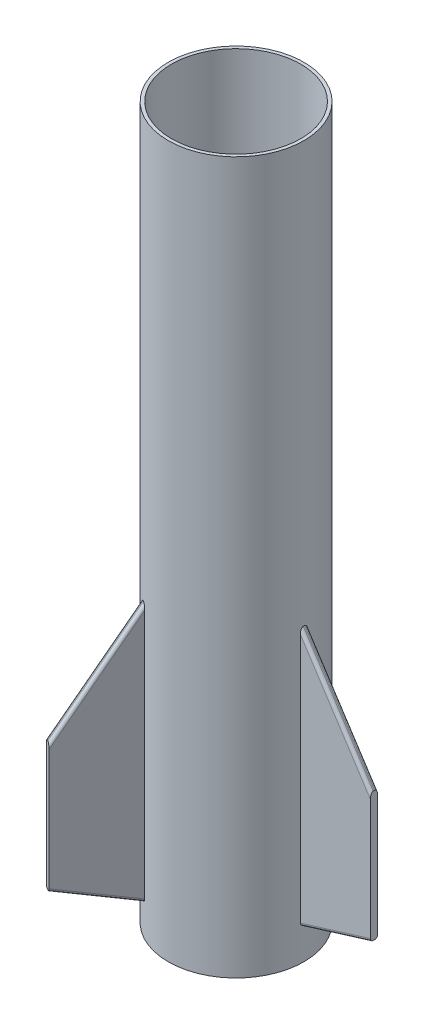
from build123d import *

# Parameters (mm, degrees)
SKETCH3_R                = 40.005
SKETCH3_R_2              = 38.1
BOSS_EXTRUDE1_DEPTH      = 419.1
BOSS_EXTRUDE2_DEPTH      = 2.159
BOSS_EXTRUDE2_DEPTH_BACK = 2.159
FILLET1_R                = 1.778
CIRPATTERN1_COUNT        = 3


with BuildPart() as part:
    # Sketch3 → Boss-Extrude1 (new body)
    with BuildSketch(Plane(origin=(0, 0, 0), x_dir=(1, 0, 0), z_dir=(0, 1, 0))):
        with Locations(Location((0, 0, 0), (0, 0, 270))):
            Circle(SKETCH3_R)
        with Locations(Location((0, 0, 0), (0, 0, 270))):
            Circle(SKETCH3_R_2, mode=Mode.SUBTRACT)
    extrude(amount=BOSS_EXTRUDE1_DEPTH)


with BuildPart() as body_2:
    # Sketch4 → Boss-Extrude2 (new, two sides: drawn at the far end of the back side and taken through both)
    with BuildSketch(Plane.XY.offset(-BOSS_EXTRUDE2_DEPTH_BACK)):
        Polygon((40.005, 19.05), (40.005, 171.45), (81.28, 107.95), (81.28, 31.75), align=None)
    extrude(amount=BOSS_EXTRUDE2_DEPTH + BOSS_EXTRUDE2_DEPTH_BACK)

    # Fillet1
    fillet1_edges = [body_2.edges().sort_by_distance(p)[0] for p in [
        (60.6425, 25.4, 2.159),
        (60.6425, 139.7, -2.159),
        (60.6425, 139.7, 2.159),
        (60.6425, 25.4, -2.159),
    ]]
    fillet(fillet1_edges, radius=FILLET1_R)


with BuildPart() as cirpattern1_1:
    # CirPattern1: pattern copy
    add(body_2.part.rotate(Axis((0, 0, 0), (0, 1, 0)), 1 * 360 / CIRPATTERN1_COUNT))


with BuildPart() as cirpattern1_2:
    # CirPattern1: pattern copy
    add(body_2.part.rotate(Axis((0, 0, 0), (0, 1, 0)), 2 * 360 / CIRPATTERN1_COUNT))


solid = Compound([part.part, body_2.part, cirpattern1_1.part, cirpattern1_2.part])
